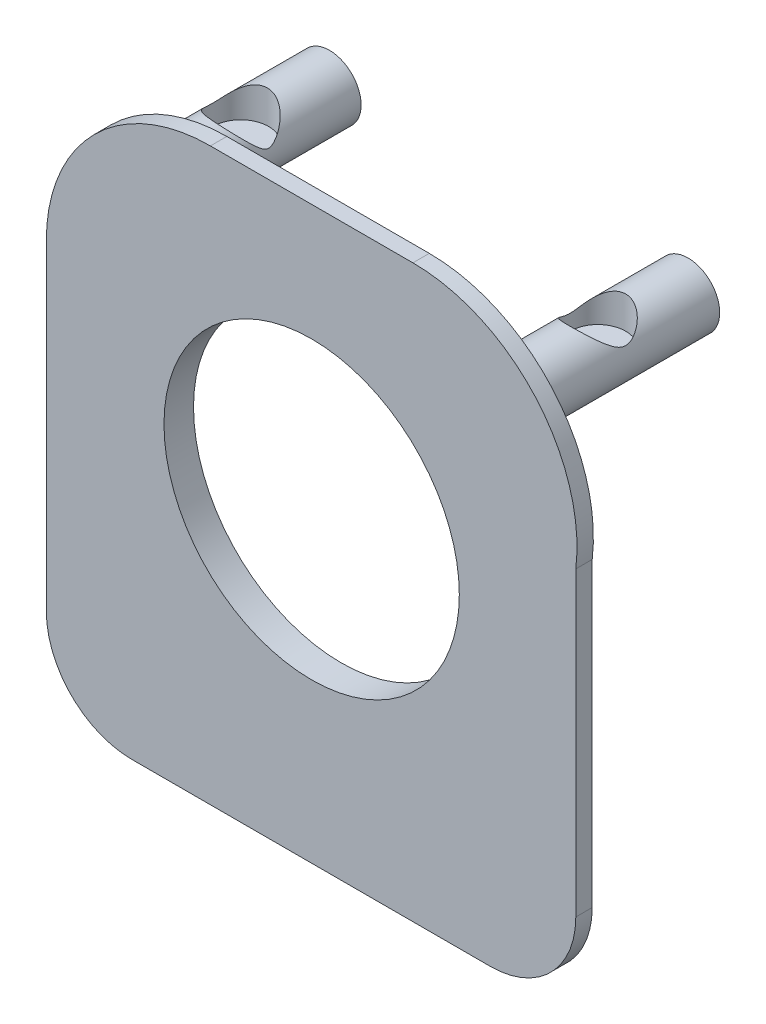
from build123d import *

# Parameters (mm, degrees)
SCHIZZO1_R                   = 12.1
ESTRUSIONE_ESTRUSIONE1_DEPTH = 1
ESTRUSIONE_ESTRUSIONE2_START = -1.8
SCHIZZO2_R                   = 12.1
SCHIZZO2_R_2                 = 9
ESTRUSIONE_ESTRUSIONE2_DEPTH = 1.8
SCHIZZO3_R                   = 1.925
ESTRUSIONE_ESTRUSIONE3_DEPTH = 11
SCHIZZO4_R                   = 1.7
TAGLIO_ESTRUSIONE1_DEPTH     = 2
TAGLIO_ESTRUSIONE2_START     = -7.2
SCHIZZO5_R                   = 1.925
TAGLIO_ESTRUSIONE2_DEPTH     = 7.2
SCHIZZO6_R                   = 1.425
ESTRUSIONE_ESTRUSIONE4_DEPTH = 3.4
SCHIZZO7_R                   = 1.925
ESTRUSIONE_ESTRUSIONE5_DEPTH = 3.8


with BuildPart() as part:
    # Schizzo1 → Estrusione-Estrusione1 (new body)
    with BuildSketch(Plane.XY):
        with BuildLine():
            Line((-6.171311325, 16.1), (6.171311325, 16.1))
            ThreePointArc((6.171311325, 16.1), (13.651991863, 12.73622021), (16.1, 4.907883736))
            Line((16.1, 4.907883736), (16.1, -13.463208293))
            ThreePointArc((16.1, -13.463208293), (14.572915114, -17.149917336), (10.886206072, -18.677002221))
            Line((10.886206072, -18.677002221), (-10.957517396, -18.677002221))
            ThreePointArc((-10.957517396, -18.677002221), (-14.644226439, -17.149917336), (-16.171311325, -13.463208293))
            Line((-16.171311325, -13.463208293), (-16.171311325, 6.1))
            ThreePointArc((-16.171311325, 6.1), (-13.242379137, 13.171067812), (-6.171311325, 16.1))
        make_face()
        Circle(SCHIZZO1_R, mode=Mode.SUBTRACT)
    extrude(amount=ESTRUSIONE_ESTRUSIONE1_DEPTH)

    # Schizzo2 → Estrusione-Estrusione2 (add)
    with BuildSketch(Plane.XY.offset(1).offset(ESTRUSIONE_ESTRUSIONE2_START)):
        Circle(SCHIZZO2_R)
        Circle(SCHIZZO2_R_2, mode=Mode.SUBTRACT)
    extrude(amount=ESTRUSIONE_ESTRUSIONE2_DEPTH)

    # Schizzo3 → Estrusione-Estrusione3 (add)
    with BuildSketch(Plane(origin=(0, 0, 0), x_dir=(-1, 0, 0), z_dir=(0, 0, -1))):
        with Locations(Location((-10.944459062, 10.817992606, 0), (0, 0, 180))):
            Circle(SCHIZZO3_R)
        with Locations(Location((10.910719744, 10.851964601, 0), (0, 0, 180))):
            Circle(SCHIZZO3_R)
        with Locations(Location((0, -15.38859776, 0), (0, 0, 180))):
            Circle(SCHIZZO3_R)
    extrude(amount=ESTRUSIONE_ESTRUSIONE3_DEPTH)

    # Schizzo4 → Taglio-Estrusione1 (cut)
    with BuildSketch(Plane(origin=(0, 12.776964601, 0), x_dir=(1, 0, 0), z_dir=(0, 1, 0))):
        with BuildLine():
            ThreePointArc((-9.045346347, 5.425199137), (-9.603228747, 6.684392286), (-10.910719744, 7.117136381))
            Line((-10.910719744, 7.117136381), (-10.910719744, 3.733261892))
            ThreePointArc((-10.910719744, 3.733261892), (-9.603228747, 4.166005987), (-9.045346347, 5.425199137))
        make_face()
        with BuildLine():
            Line((-10.910719744, 3.733261892), (-10.910719744, 7.117136381))
            ThreePointArc((-10.910719744, 7.117136381), (-12.445346347, 5.425199137), (-10.910719744, 3.733261892))
        make_face()
        with Locations(Location((10.944459062, 5.5, 0), (0, 0, 270))):
            Circle(SCHIZZO4_R)
    extrude(amount=-TAGLIO_ESTRUSIONE1_DEPTH, mode=Mode.SUBTRACT)

    # Schizzo5 → Taglio-Estrusione2 (cut)
    with BuildSketch(Plane(origin=(0, 0, -11), x_dir=(-1, 0, 0), z_dir=(0, 0, -1)).offset(TAGLIO_ESTRUSIONE2_START)):
        with Locations(Location((0, -15.38859776, 0), (0, 0, 180))):
            Circle(SCHIZZO5_R)
    extrude(amount=TAGLIO_ESTRUSIONE2_DEPTH, mode=Mode.SUBTRACT)

    # Schizzo6 → Estrusione-Estrusione4 (add)
    with BuildSketch(Plane(origin=(0, 0, -3.8), x_dir=(-1, 0, 0), z_dir=(0, 0, -1))):
        with Locations((0, -15.38859776)):
            Circle(SCHIZZO6_R)
    extrude(amount=ESTRUSIONE_ESTRUSIONE4_DEPTH)

    # Schizzo7 → Estrusione-Estrusione5 (add)
    with BuildSketch(Plane(origin=(0, 0, -7.2), x_dir=(-1, 0, 0), z_dir=(0, 0, -1))):
        with Locations(Location((0, -15.38859776, 0), (0, 0, 180))):
            Circle(SCHIZZO7_R)
    extrude(amount=ESTRUSIONE_ESTRUSIONE5_DEPTH)


solid = part.part
